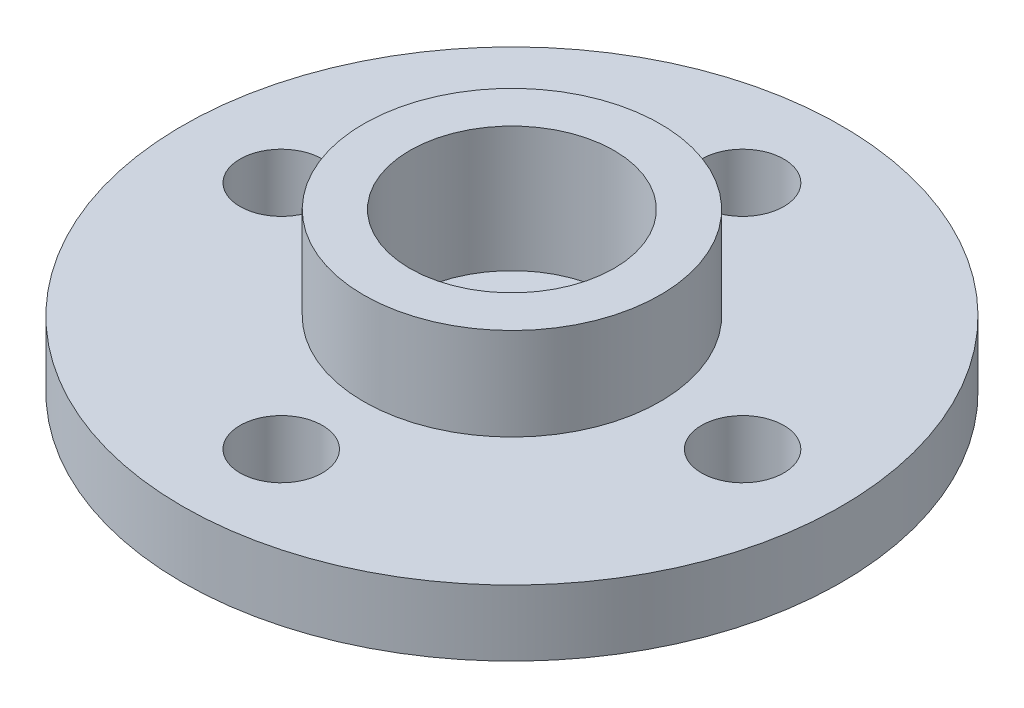
from build123d import *

# Parameters (mm, degrees)
SKETCH_1_R                      = 10
EXTRUDE_1_DEPTH                 = 2
SKETCH_2_R                      = 4.5
EXTRUDE_2_DEPTH                 = 2.8
SKETCH_3_R                      = 3.1
CUT_EXTRUDE_1_DEPTH             = 3.8
CUT_EXTRUDE_2_REACH             = 16.644
SKETCH_4_R                      = 1.6
CUT_EXTRUDE_2_DIRECTION_2_DEPTH = 15.643770006
CUT_EXTRUDE_3_REACH             = 16.417
SKETCH_5_R                      = 1.25


with BuildPart() as part:
    # 草图1 → 凸台-拉伸1 (new body)
    with BuildSketch(Plane(origin=(0, 0, 0), x_dir=(1, 0, 0), z_dir=(0, 1, 0))):
        with Locations(Location((0, 0, 0), (0, 0, 270))):
            Circle(SKETCH_1_R)
    extrude(amount=EXTRUDE_1_DEPTH)

    # 草图2 → 凸台-拉伸2 (add)
    with BuildSketch(Plane(origin=(0, 2, 0), x_dir=(1, 0, 0), z_dir=(0, 1, 0))):
        with Locations(Location((0, 0, 0), (0, 0, 270))):
            Circle(SKETCH_2_R)
    extrude(amount=EXTRUDE_2_DEPTH)

    # 草图3 → 切除-拉伸1 (cut)
    with BuildSketch(Plane(origin=(0, 4.8, 0), x_dir=(1, 0, 0), z_dir=(0, 1, 0))):
        with Locations(Location((0, 0, 0), (0, 0, 270))):
            Circle(SKETCH_3_R)
    extrude(amount=-CUT_EXTRUDE_1_DEPTH, mode=Mode.SUBTRACT)

    # 草图4 → 切除-拉伸2 (cut, up to next)
    with BuildSketch(Plane(origin=(0, 1, 0), x_dir=(1, 0, 0), z_dir=(0, 1, 0)), mode=Mode.PRIVATE) as cut_extrude_2_sk1:
        with Locations(Location((0, 0, 0), (0, 0, 90))):
            Circle(SKETCH_4_R)
    cut_extrude_2_tool1 = extrude(cut_extrude_2_sk1.sketch, amount=-CUT_EXTRUDE_2_REACH, mode=Mode.PRIVATE) & part.part
    add(cut_extrude_2_tool1.solids().sort_by_distance((0, 1, 0))[0], mode=Mode.SUBTRACT)

    # 草图4 → 切除-拉伸2 direction 2 (cut)
    with BuildSketch(Plane(origin=(0, 1, 0), x_dir=(1, 0, 0), z_dir=(0, 1, 0))):
        with Locations(Location((0, 0, 0), (0, 0, 90))):
            Circle(SKETCH_4_R)
    extrude(amount=CUT_EXTRUDE_2_DIRECTION_2_DEPTH, mode=Mode.SUBTRACT)

    # 草图5 → 切除-拉伸3 (cut, up to next)
    with BuildSketch(Plane(origin=(0, 2, 0), x_dir=(1, 0, 0), z_dir=(0, 1, 0)), mode=Mode.PRIVATE) as cut_extrude_3_sk1:
        with Locations(Location((-7, 0, 0), (0, 0, 270))):
            Circle(SKETCH_5_R)
    cut_extrude_3_tool1 = extrude(cut_extrude_3_sk1.sketch, amount=-CUT_EXTRUDE_3_REACH, mode=Mode.PRIVATE) & part.part
    # 草图5 → 切除-拉伸3 (cut, up to next)
    with BuildSketch(Plane(origin=(0, 2, 0), x_dir=(1, 0, 0), z_dir=(0, 1, 0)), mode=Mode.PRIVATE) as cut_extrude_3_sk2:
        with Locations(Location((0, 7, 0), (0, 0, 270))):
            Circle(SKETCH_5_R)
    cut_extrude_3_tool2 = extrude(cut_extrude_3_sk2.sketch, amount=-CUT_EXTRUDE_3_REACH, mode=Mode.PRIVATE) & part.part
    # 草图5 → 切除-拉伸3 (cut, up to next)
    with BuildSketch(Plane(origin=(0, 2, 0), x_dir=(1, 0, 0), z_dir=(0, 1, 0)), mode=Mode.PRIVATE) as cut_extrude_3_sk3:
        with Locations(Location((7, 0, 0), (0, 0, 270))):
            Circle(SKETCH_5_R)
    cut_extrude_3_tool3 = extrude(cut_extrude_3_sk3.sketch, amount=-CUT_EXTRUDE_3_REACH, mode=Mode.PRIVATE) & part.part
    # 草图5 → 切除-拉伸3 (cut, up to next)
    with BuildSketch(Plane(origin=(0, 2, 0), x_dir=(1, 0, 0), z_dir=(0, 1, 0)), mode=Mode.PRIVATE) as cut_extrude_3_sk4:
        with Locations(Location((0, -7, 0), (0, 0, 270))):
            Circle(SKETCH_5_R)
    cut_extrude_3_tool4 = extrude(cut_extrude_3_sk4.sketch, amount=-CUT_EXTRUDE_3_REACH, mode=Mode.PRIVATE) & part.part
    add(cut_extrude_3_tool1.solids().sort_by_distance((-7, 2, 0))[0], mode=Mode.SUBTRACT)
    add(cut_extrude_3_tool2.solids().sort_by_distance((0, 2, -7))[0], mode=Mode.SUBTRACT)
    add(cut_extrude_3_tool3.solids().sort_by_distance((7, 2, 0))[0], mode=Mode.SUBTRACT)
    add(cut_extrude_3_tool4.solids().sort_by_distance((0, 2, 7))[0], mode=Mode.SUBTRACT)


solid = part.part
